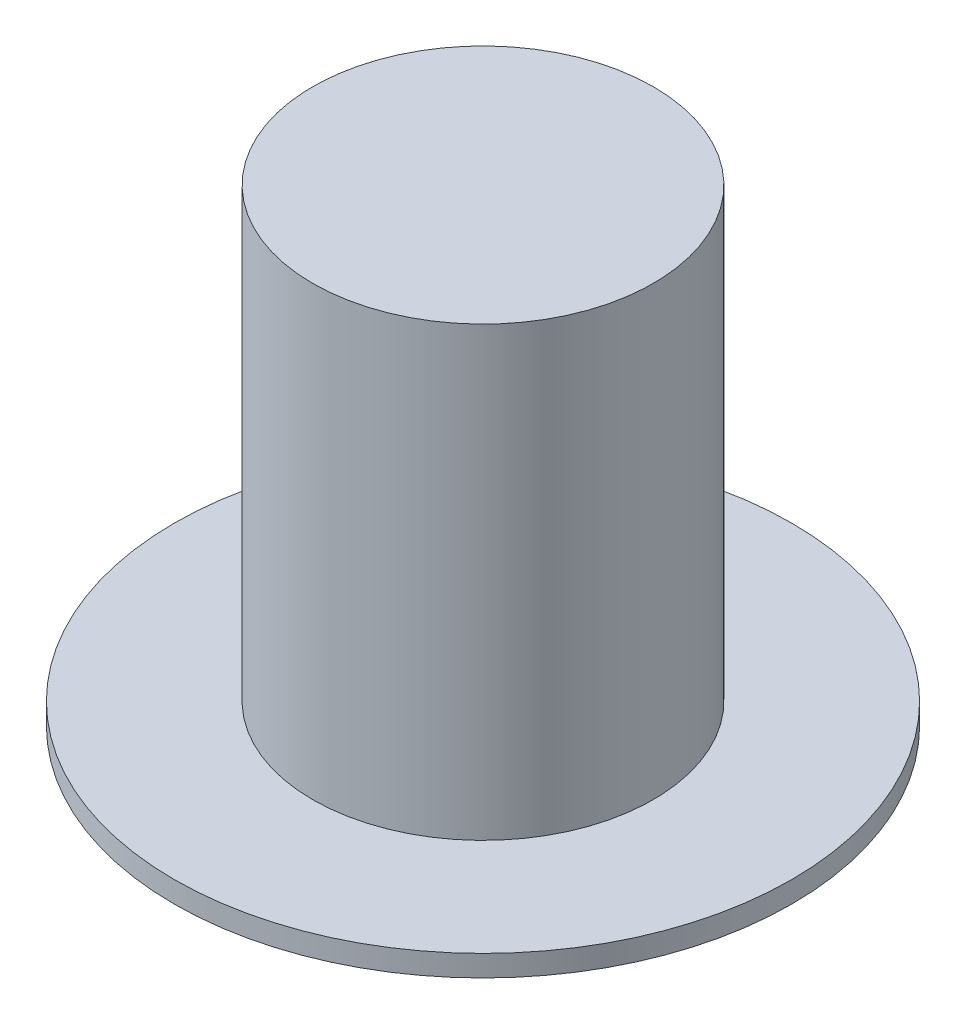
from build123d import *

# Parameters (mm, degrees)
SKETCH_1_R          = 14.5
EXTRUDE_1_DEPTH     = 1
SKETCH_3_R          = 8
EXTRUDE_3_DEPTH     = 21
SKETCH_4_W          = 2
SKETCH_4_H          = 13
CUT_EXTRUDE_1_DEPTH = 10
SKETCH_5_W          = 2
SKETCH_5_H          = 2
EXTRUDE_4_DEPTH     = 1


with BuildPart() as part:
    # 草图1 → 拉伸1 (new body)
    with BuildSketch(Plane(origin=(0, 0, 0), x_dir=(1, 0, 0), z_dir=(0, 1, 0))):
        with Locations(Location((0, 0, 0), (0, 0, 270))):
            Circle(SKETCH_1_R)
    extrude(amount=EXTRUDE_1_DEPTH)

    # 草图3 → 拉伸3 (add)
    with BuildSketch(Plane(origin=(0, 1, 0), x_dir=(-1, 0, 0), z_dir=(0, 1, 0))):
        with Locations(Location((0, 0, 0), (0, 0, 270))):
            Circle(SKETCH_3_R)
    extrude(amount=EXTRUDE_3_DEPTH)

    # 草图4 → 切除-拉伸1 (cut)
    with BuildSketch(Plane(origin=(0, 0, 0), x_dir=(-1, 0, 0), z_dir=(0, 1, 0))):
        Rectangle(SKETCH_4_W, SKETCH_4_H)
    extrude(amount=CUT_EXTRUDE_1_DEPTH, mode=Mode.SUBTRACT)

    # 草图5 → 拉伸4 (add)
    with BuildSketch(Plane.XZ.offset(-10)):
        Rectangle(SKETCH_5_W, SKETCH_5_H)
    extrude(amount=EXTRUDE_4_DEPTH)


solid = part.part
